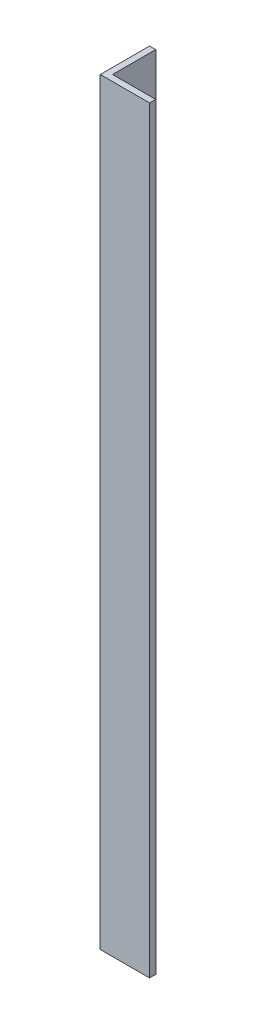
from build123d import *

# Parameters (mm, degrees)
SALIENTE_EXTRUIR1_DEPTH = 1170.475


with BuildPart() as part:
    # Croquis1 → Saliente-Extruir1 (new body)
    with BuildSketch(Plane(origin=(0, 0, 0), x_dir=(1, 0, 0), z_dir=(0, 1, 0))):
        Polygon((76.2, 9.525), (76.2, 0), (0, 0), (0, 76.2), (9.525, 76.2), (9.525, 9.525), align=None)
    extrude(amount=SALIENTE_EXTRUIR1_DEPTH)


solid = part.part
